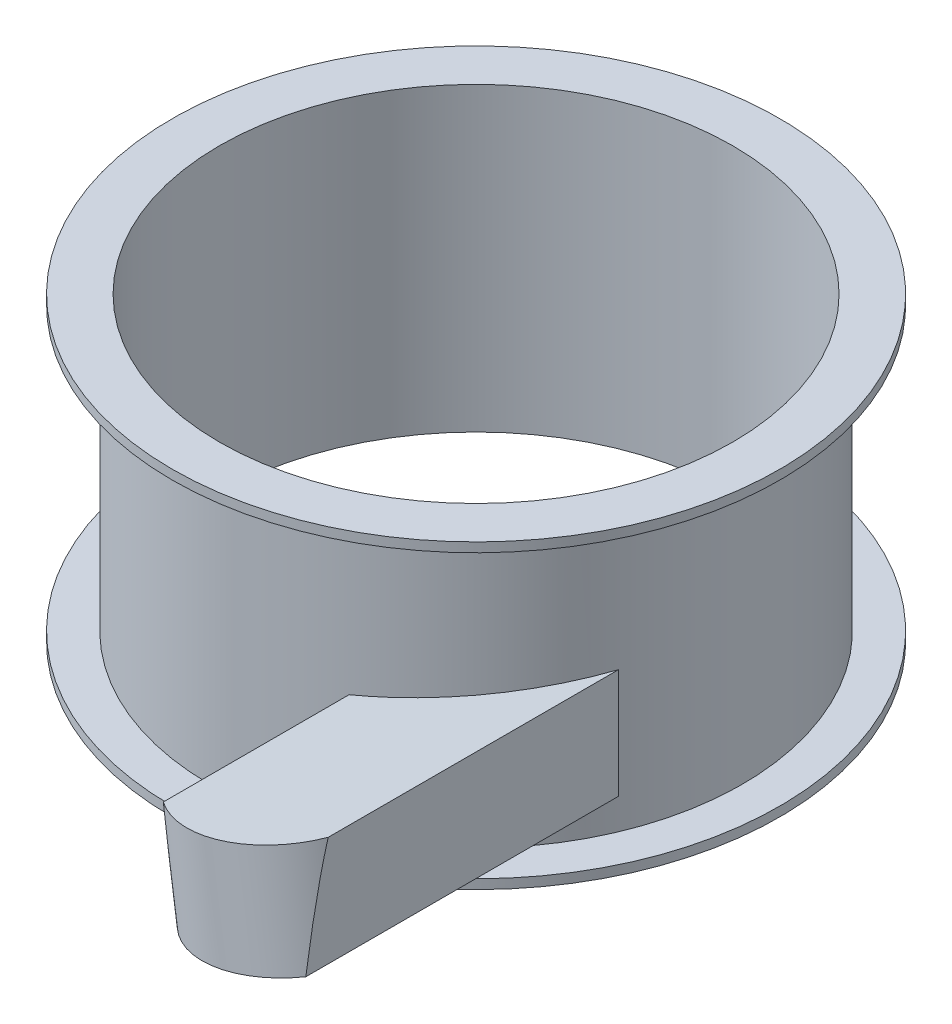
from build123d import *

# Parameters (mm, degrees)
BOSS_EXTRUDE2_DEPTH     = 101
CUT_EXTRUDE3_DEPTH      = 427.519947779
CUT_EXTRUDE3_DEPTH_BACK = 427.519947779
CUT_EXTRUDE4_DEPTH      = 424.573467382
CUT_EXTRUDE4_DEPTH_BACK = 64
SKETCH5_R               = 28.146504222
CUT_EXTRUDE7_DEPTH      = 36
CUT_EXTRUDE7_DEPTH_BACK = 113
CUT_EXTRUDE8_DEPTH      = 414.870820929
CUT_EXTRUDE8_DEPTH_BACK = 414.870820929
SKETCH8_R               = 136.4


with BuildPart() as part:
    # Sketch1 → Revolve1 (revolve)
    with BuildSketch(Plane.XY, mode=Mode.PRIVATE) as revolve1_sk:
        Polygon((0, 0), (-20, 0), (-20, -5), (5, -5), (141.4, -5), (141.4, 150), (141.4, 155), (-20, 155), (-20, 150), (0, 150), align=None)
    revolve(revolve1_sk.sketch.rotate(Axis((141.4, 150, 0), (0, -1, 0)), 270), axis=Axis((141.4, 150, 0), (0, -1, 0)))

    # Sketch3 → Boss-Extrude2 (add, symmetric)
    with BuildSketch(Plane.XY.offset(140)):
        Polygon((271.787755102, 74.631332533), (201.787755102, 64.685114046), (201.787755102, 6.428691477), (271.787755102, 16.374909964), align=None)
    extrude(amount=BOSS_EXTRUDE2_DEPTH, both=True)

    # Sketch4 → Cut-Extrude3 (cut, two sides: drawn at the far end of the back side and taken through both)
    with BuildSketch(Plane(origin=(4.504708933, -31.703468583, 0), x_dir=(-0.9900557063765247, -0.1406758624330439, 0), z_dir=(0.1406758624330439, -0.9900557063765248, 0)).offset(-CUT_EXTRUDE3_DEPTH_BACK)):
        with BuildLine():
            Line((-283.0966697, -198.98279485), (-292.524457183, -243.549272165))
            Line((-292.524457183, -243.549272165), (-246.6966359, -274.042125065))
            Line((-246.6966359, -274.042125065), (-190.71002304, -274.042125065))
            Line((-190.71002304, -274.042125065), (-190.71002304, -198.98279485))
            ThreePointArc((-190.71002304, -198.98279485), (-236.90334637, -235.746084626), (-283.0966697, -198.98279485))
        make_face()
    extrude(amount=CUT_EXTRUDE3_DEPTH + CUT_EXTRUDE3_DEPTH_BACK, mode=Mode.SUBTRACT)

    # Sketch5 → Cut-Extrude4 (cut, two sides: drawn at the far end of the back side and taken through both)
    with BuildSketch(Plane(origin=(4.504708933, -31.703468583, 0), x_dir=(-0.9900557063765247, -0.1406758624330439, 0), z_dir=(0.1406758624330439, -0.9900557063765248, 0)).offset(-CUT_EXTRUDE4_DEPTH_BACK)):
        with Locations((-236.587007924, -195.244994695)):
            Circle(SKETCH5_R)
    extrude(amount=CUT_EXTRUDE4_DEPTH + CUT_EXTRUDE4_DEPTH_BACK, mode=Mode.SUBTRACT)

    # Sketch6 → Cut-Extrude7 (cut, two sides: drawn at the far end of the back side and taken through both)
    with BuildSketch(Plane.XY.offset(140).offset(-CUT_EXTRUDE7_DEPTH_BACK)):
        Polygon((206.787755102, 60.42244898), (206.787755102, 12.189356534), (266.787755102, 20.714686666), (266.787755102, 68.852201046), align=None)
    extrude(amount=CUT_EXTRUDE7_DEPTH + CUT_EXTRUDE7_DEPTH_BACK, mode=Mode.SUBTRACT)

    # Sketch8 → Cut-Extrude8 (cut, two sides: drawn at the far end of the back side and taken through both)
    with BuildSketch(Plane(origin=(0, 0, 0), x_dir=(1, 0, 0), z_dir=(0, 1, 0)).offset(-CUT_EXTRUDE8_DEPTH_BACK)):
        with Locations(Location((141.4, 0, 0), (0, 0, 270))):
            Circle(SKETCH8_R)
    extrude(amount=CUT_EXTRUDE8_DEPTH + CUT_EXTRUDE8_DEPTH_BACK, mode=Mode.SUBTRACT)


solid = part.part
